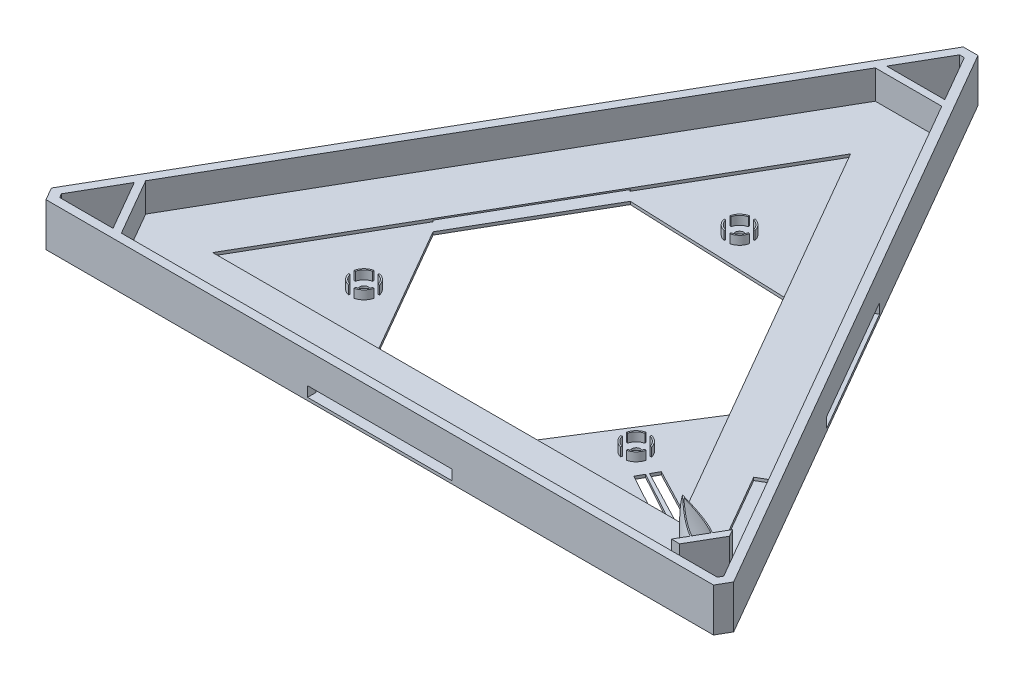
from build123d import *

# Parameters (mm, degrees)
SKETCH1_W                = 34.714871786
SKETCH1_H                = 6
BOSS_EXTRUDE1_DEPTH      = 1
BOSS_EXTRUDE2_DEPTH      = 11
BOSS_EXTRUDE3_DEPTH      = 5
BOSS_EXTRUDE3_DEPTH_BACK = 3
SKETCH3_W                = 50
SKETCH3_H                = 7
CUT_EXTRUDE3_DEPTH       = 25
SKETCH5_W                = 50
SKETCH5_H                = 7
CUT_EXTRUDE4_DEPTH       = 25
SKETCH6_W                = 50
SKETCH6_H                = 7
CUT_EXTRUDE5_DEPTH       = 25
SKETCH8_R                = 1.500000001
SKETCH8_R_2              = 1.499999999
BOSS_EXTRUDE5_DEPTH      = 1
BOSS_EXTRUDE10_DEPTH     = 3
REVOLVE1_ANGLE           = 90
SKETCH15_W               = 7.87412369
SKETCH15_H               = 12.308031651
CUT_EXTRUDE7_DEPTH       = 38


with BuildPart() as part:
    # Sketch1 → Boss-Extrude1 (new body)
    with BuildSketch(Plane(origin=(0, 0, 0), x_dir=(1, 0, 0), z_dir=(0, 1, 0))):
        Polygon((243.304219779, -116.484791863), (254.809280582, -136.408896135), (442.60209075, -136.409305398), (444.621046679, -132.925433226), (441.749040748, -132.925433226), (449.516726724, -119.47140646), (450.964695301, -121.978953126), (452.699916625, -118.984688022), (358.778179038, 43.666038061), (335.767496282, 43.666038061), align=None)
        with Locations((422.370878913, -131.984588005)):
            Rectangle(SKETCH1_W, SKETCH1_H, mode=Mode.SUBTRACT)
        Polygon((450.119365975, -117.364996826), (444.923425166, -120.365363323), (427.455346217, -90.114690822), (432.651287025, -87.114324326), align=None, mode=Mode.SUBTRACT)
        Polygon((428.11367092, -116.417164682), (266.43910827, -116.428009228), (347.273609731, 23.609230811), align=None, mode=Mode.SUBTRACT)
    extrude(amount=BOSS_EXTRUDE1_DEPTH)

    # Sketch1<9> → Boss-Extrude2 (add)
    # profile 1 of 2: a face of its own
    with BuildSketch(Plane(origin=(0, 0, 0), x_dir=(1, 0, 0), z_dir=(0, 1, 0))):
        Polygon((229.15943255, -134.984249185), (231.716666588, -139.412373829), (462.829865412, -139.412373829), (465.38624875, -134.984588004), (349.829542096, 65.165499075), (344.716133219, 65.165499075), align=None)
        Polygon((251.922647994, -136.409305396), (233.446303405, -136.408896135), (232.623553965, -134.984217354), (241.860901694, -118.984688016), align=None, mode=Mode.SUBTRACT)
        Polygon((442.60209075, -136.409305398), (254.809280582, -136.408896135), (243.304219779, -116.484791863), (335.767496282, 43.666038061), (358.778179038, 43.666038061), (461.938967961, -134.98458801), (461.116393749, -136.409305398), align=None, mode=Mode.SUBTRACT)
        Polygon((348.096628302, 62.164013367), (357.334800991, 46.166038067), (337.210874326, 46.166038067), (346.44844193, 62.165948237), align=None, mode=Mode.SUBTRACT)
    # profile 2 of 2: a face of its own
    with BuildSketch(Plane(origin=(0, 0, 0), x_dir=(1, 0, 0), z_dir=(0, 1, 0))):
        Polygon((441.749040748, -132.925433226), (444.621046679, -132.925433226), (450.964695301, -121.978953126), (449.516726724, -119.47140646), align=None)
    extrude(amount=BOSS_EXTRUDE2_DEPTH)

    # Sketch1<10> → Boss-Extrude3 (add, two sides: drawn at the far end of the back side and taken through both)
    # profile 1 of 2: a face of its own
    with BuildSketch(Plane(origin=(0, 0, 0), x_dir=(1, 0, 0), z_dir=(0, 1, 0)).offset(-BOSS_EXTRUDE3_DEPTH_BACK)):
        Polygon((229.15943255, -134.984249185), (231.716666588, -139.412373829), (462.829865412, -139.412373829), (465.38624875, -134.984588004), (349.829542096, 65.165499075), (344.716133219, 65.165499075), align=None)
        Polygon((251.922647994, -136.409305396), (233.446303405, -136.408896135), (232.623553965, -134.984217354), (241.860901694, -118.984688016), align=None, mode=Mode.SUBTRACT)
        Polygon((442.60209075, -136.409305398), (254.809280582, -136.408896135), (243.304219779, -116.484791863), (335.767496282, 43.666038061), (358.778179038, 43.666038061), (461.938967961, -134.98458801), (461.116393749, -136.409305398), align=None, mode=Mode.SUBTRACT)
        Polygon((348.096628302, 62.164013367), (357.334800991, 46.166038067), (337.210874326, 46.166038067), (346.44844193, 62.165948237), align=None, mode=Mode.SUBTRACT)
    # profile 2 of 2: a face of its own
    with BuildSketch(Plane(origin=(0, 0, 0), x_dir=(1, 0, 0), z_dir=(0, 1, 0)).offset(-BOSS_EXTRUDE3_DEPTH_BACK)):
        Polygon((441.749040748, -132.925433226), (444.621046679, -132.925433226), (450.964695301, -121.978953126), (449.516726724, -119.47140646), align=None)
    extrude(amount=BOSS_EXTRUDE3_DEPTH + BOSS_EXTRUDE3_DEPTH_BACK)

    # Sketch3 → Cut-Extrude3 (cut)
    with BuildSketch(Plane(origin=(290.589645397, 0, -167.772009994), x_dir=(-0.49999999999998745, 0, -0.8660254037844459), z_dir=(0.8660254037844459, 0, -0.49999999999998745))):
        with Locations((-236.592990632, -3)):
            Rectangle(SKETCH3_W, SKETCH3_H)
    extrude(amount=-CUT_EXTRUDE3_DEPTH, mode=Mode.SUBTRACT)

    # Sketch5 → Cut-Extrude4 (cut)
    with BuildSketch(Plane.XY.offset(139.412373829)):
        with Locations((347.273266, -3)):
            Rectangle(SKETCH5_W, SKETCH5_H)
    extrude(amount=-CUT_EXTRUDE4_DEPTH, mode=Mode.SUBTRACT)

    # Sketch6 → Cut-Extrude5 (cut)
    with BuildSketch(Plane(origin=(230.319375802, 0, 132.975171836), x_dir=(-0.5000006153901599, 0, 0.8660250484884727), z_dir=(-0.8660250484884727, 0, -0.5000006153901599))):
        with Locations((-113.236674797, -3)):
            Rectangle(SKETCH6_W, SKETCH6_H)
    extrude(amount=-CUT_EXTRUDE5_DEPTH, mode=Mode.SUBTRACT)

    # Sketch8 → Boss-Extrude5 (add)
    with BuildSketch(Plane.XZ.offset(3)):
        Polygon((349.829542096, -65.165499075), (465.38624875, 134.984588004), (462.829865412, 139.412373829), (231.716666588, 139.412373829), (229.15943255, 134.984249185), (344.716133219, -65.165499075), align=None)
        with Locations((395.323540807, 98.692824233)):
            Circle(SKETCH8_R, mode=Mode.SUBTRACT)
        with Locations((348.301285092, 15.86352663)):
            Circle(SKETCH8_R_2, mode=Mode.SUBTRACT)
        with Locations((299.654911442, 97.241681778)):
            Circle(SKETCH8_R, mode=Mode.SUBTRACT)
        Polygon((444.621046678, 132.925433226), (450.9646953, 121.978953126), (449.516726723, 119.47140646), (427.347592194, 115.090208206), (404.332986149, 103.060878104), (405.774939108, 100.430142149), (424.549299543, 110.243170392), (451.871255231, 117.549638152), (452.699916625, 118.984688022), (461.93896796, 134.98458801), (461.116393748, 136.409305398), (442.602090749, 136.409305398), (439.019602541, 136.409297591), (420.379437569, 116.417683466), (402.410382204, 106.568526043), (403.852335163, 103.937790089), (426.620208945, 116.417264858), (441.749040748, 132.925433226), align=None, mode=Mode.SUBTRACT)
        Polygon((322.273266, 116.424264074), (294.35821863, 68.061097963), (319.354499369, 24.757680454), (376.473657314, 26.969372807), (401.472679509, 70.271207532), (372.273266, 116.420910254), align=None, mode=Mode.SUBTRACT)
        Polygon((233.446303405, 136.408896135), (251.922647993, 136.409305396), (241.860901693, 118.984688015), (232.623553964, 134.984217354), align=None, mode=Mode.SUBTRACT)
        Polygon((337.210874326, -46.166038067), (357.334800991, -46.166038067), (348.096628302, -62.164013367), (346.44844193, -62.165948237), align=None, mode=Mode.SUBTRACT)
    extrude(amount=BOSS_EXTRUDE5_DEPTH)

    # Sketch12 → Boss-Extrude10 (add)
    with BuildSketch(Plane(origin=(0, -3, 0), x_dir=(1, 0, 0), z_dir=(0, 1, 0))):
        with BuildLine():
            ThreePointArc((352.690173981, -14.86971864), (351.483265607, -12.681546115), (349.295093082, -11.474637741))
            Line((349.295093082, -11.474637742), (349.184669972, -11.962292063))
            ThreePointArc((349.184669972, -11.962292062), (351.129712217, -13.035099505), (352.20251966, -14.98014175))
            Line((352.20251966, -14.98014175), (352.690173981, -14.86971864))
        make_face()
        with BuildLine():
            Line((347.417900212, -11.962292063), (347.307477102, -11.474637742))
            ThreePointArc((347.307477102, -11.474637741), (345.119304576, -12.681546115), (343.912396203, -14.86971864))
            Line((343.912396203, -14.86971864), (344.400050524, -14.98014175))
            ThreePointArc((344.400050524, -14.98014175), (345.472857967, -13.035099505), (347.417900212, -11.962292062))
        make_face()
        with BuildLine():
            ThreePointArc((349.295093082, -20.25241552), (351.483265607, -19.045507146), (352.690173981, -16.85733462))
            Line((352.690173981, -16.85733462), (352.20251966, -16.74691151))
            ThreePointArc((352.20251966, -16.74691151), (351.129712217, -18.691953755), (349.184669972, -19.764761199))
            Line((349.184669972, -19.764761198), (349.295093082, -20.252415519))
        make_face()
        with BuildLine():
            Line((344.400050524, -16.74691151), (343.912396203, -16.85733462))
            ThreePointArc((343.912396203, -16.85733462), (345.119304576, -19.045507146), (347.307477102, -20.25241552))
            Line((347.307477102, -20.252415519), (347.417900212, -19.764761198))
            ThreePointArc((347.417900212, -19.764761199), (345.472857967, -18.691953755), (344.400050524, -16.74691151))
        make_face()
        with BuildLine():
            Line((394.440155927, -94.791589665), (394.329732817, -94.303935344))
            ThreePointArc((394.329732817, -94.303935343), (392.141560291, -95.510843717), (390.934651917, -97.699016243))
            Line((390.934651918, -97.699016243), (391.424789599, -97.798542944))
            ThreePointArc((391.424789599, -97.798542944), (392.499067688, -95.860448621), (394.440155927, -94.791589664))
        make_face()
        with BuildLine():
            ThreePointArc((399.712429696, -97.699016243), (398.505521322, -95.510843717), (396.317348797, -94.303935343))
            Line((396.317348797, -94.303935344), (396.206925687, -94.791589665))
            ThreePointArc((396.206925687, -94.791589664), (398.151967932, -95.864397108), (399.224775375, -97.809439353))
            Line((399.224775375, -97.809439353), (399.712429695, -97.699016243))
        make_face()
        with BuildLine():
            Line((391.422306239, -99.576209113), (390.934651918, -99.686632223))
            ThreePointArc((390.934651917, -99.686632223), (392.141560291, -101.874804748), (394.329732817, -103.081713122))
            Line((394.329732817, -103.081713121), (394.440155927, -102.5940588))
            ThreePointArc((394.440155927, -102.594058801), (392.495113682, -101.521251358), (391.422306238, -99.576209113))
        make_face()
        with BuildLine():
            ThreePointArc((396.317348797, -103.081713122), (398.505521322, -101.874804748), (399.712429696, -99.686632223))
            Line((399.712429695, -99.686632223), (399.224775375, -99.576209113))
            ThreePointArc((399.224775375, -99.576209113), (398.151967932, -101.521251358), (396.206925687, -102.594058801))
            Line((396.206925687, -102.5940588), (396.317348797, -103.081713121))
        make_face()
        with BuildLine():
            ThreePointArc((298.661103452, -92.85279289), (296.472930928, -94.059701263), (295.266022554, -96.247873788))
            Line((295.266022553, -96.247873788), (295.753676874, -96.358296898))
            ThreePointArc((295.753676875, -96.358296898), (296.826484318, -94.413254654), (298.771526562, -93.340447211))
            Line((298.771526562, -93.34044721), (298.661103452, -92.852792889))
        make_face()
        with BuildLine():
            Line((295.753676874, -98.125066658), (295.266022553, -98.235489768))
            ThreePointArc((295.266022554, -98.235489767), (296.472930928, -100.423662292), (298.661103452, -101.630570665))
            Line((298.661103452, -101.630570666), (298.771526562, -101.142916345))
            ThreePointArc((298.771526562, -101.142916344), (296.826484318, -100.070108901), (295.753676875, -98.125066657))
        make_face()
        with BuildLine():
            ThreePointArc((304.04380033, -96.247873788), (302.836891957, -94.059701263), (300.648719432, -92.85279289))
            Line((300.648719432, -92.852792889), (300.538296322, -93.34044721))
            ThreePointArc((300.538296322, -93.340447211), (302.483338566, -94.413254654), (303.556146009, -96.358296898))
            Line((303.55614601, -96.358296898), (304.043800331, -96.247873788))
        make_face()
        with BuildLine():
            Line((300.538296322, -101.142916345), (300.648719432, -101.630570666))
            ThreePointArc((300.648719432, -101.630570665), (302.836891957, -100.423662292), (304.04380033, -98.235489767))
            Line((304.043800331, -98.235489768), (303.55614601, -98.125066658))
            ThreePointArc((303.556146009, -98.125066657), (302.483338566, -100.070108901), (300.538296322, -101.142916344))
        make_face()
    extrude(amount=BOSS_EXTRUDE10_DEPTH)

    # Sketch13 → Revolve1 (revolve)
    with BuildSketch(Plane(origin=(0, 1, 0), x_dir=(1, 0, 0), z_dir=(0, 1, 0))):
        Polygon((448.425771751, -121.360995899), (428.11367092, -116.417164681), (442.800303922, -131.104591996), (443.050303922, -130.671579294), (428.985837114, -116.90637438), (448.175771751, -121.794008601), align=None)
    revolve(axis=Axis((442.800303922, 1, 131.104591996), (0.5000000000000009, 0, -0.8660254037844383)), revolution_arc=REVOLVE1_ANGLE)

    # Sketch15 → Cut-Extrude7 (cut)
    with BuildSketch(Plane(origin=(388.870181552, 0, 224.514303999), x_dir=(0.5000000000000009, -5.733535551193207e-15, -0.8660254037844383), z_dir=(0.8660254037844382, -9.930774881669059e-15, 0.5000000000000008))):
        with Locations((114.477088338, 17.154015826)):
            Rectangle(SKETCH15_W, SKETCH15_H)
    extrude(amount=-CUT_EXTRUDE7_DEPTH, mode=Mode.SUBTRACT)


solid = part.part
